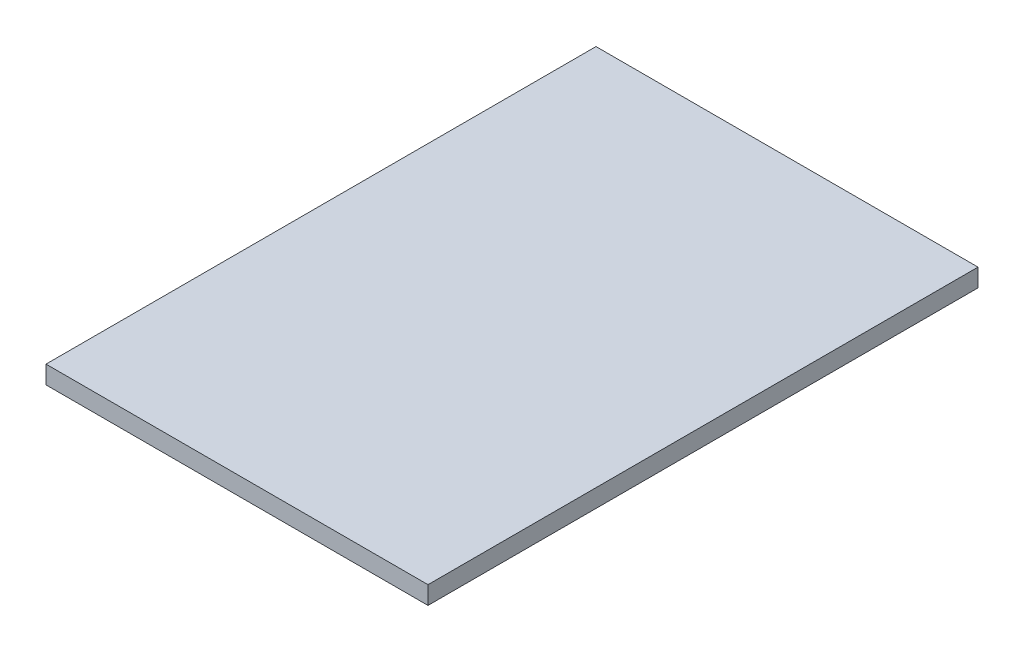
from build123d import *

# Parameters (mm, degrees)
SKETCH1_W           = 382
SKETCH1_H           = 550
BOSS_EXTRUDE1_DEPTH = 18


with BuildPart() as part:
    # Sketch1 → Boss-Extrude1 (new body)
    with BuildSketch(Plane(origin=(0, 0, 0), x_dir=(1, 0, 0), z_dir=(0, 1, 0))):
        Rectangle(SKETCH1_W, SKETCH1_H)
    extrude(amount=BOSS_EXTRUDE1_DEPTH)


solid = part.part
